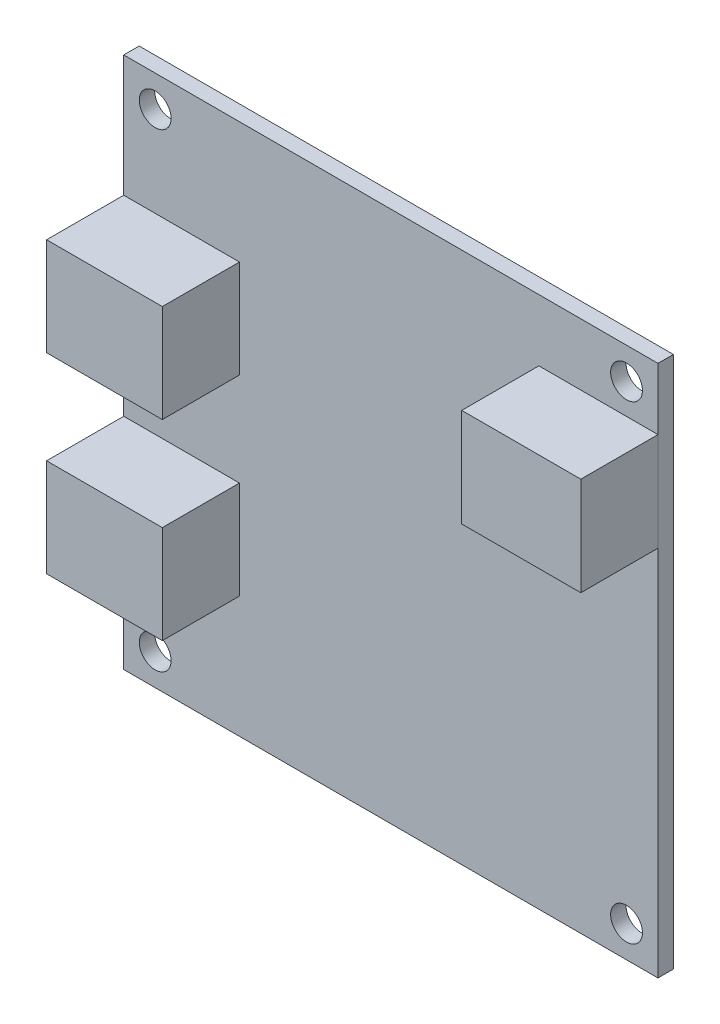
from build123d import *

# Parameters (mm, degrees)
SKETCH_1_W        = 55.4
SKETCH_1_H        = 55.2
SKETCH_1_R        = 1.65
EXTRUDE_1_DEPTH   = 1.6
SKETCH_1_3_W      = 12
SKETCH_1_3_H      = 10.15
EXTRUDE_2_DEPTH   = 8
EXTRUDE_2_2_DEPTH = 8
SKETCH_1_4_W      = 12.35
SKETCH_1_4_H      = 10.2
EXTRUDE_3_DEPTH   = 8


with BuildPart() as part:
    # 스케치1 → 보스-돌출1 (new body)
    with BuildSketch(Plane.XY):
        Rectangle(SKETCH_1_W, SKETCH_1_H)
        with Locations((-24.438224638, -24.35)):
            Circle(SKETCH_1_R, mode=Mode.SUBTRACT)
        with Locations((24.438224638, -24.35)):
            Circle(SKETCH_1_R, mode=Mode.SUBTRACT)
        with Locations((-24.438224638, 24.35)):
            Circle(SKETCH_1_R, mode=Mode.SUBTRACT)
        with Locations((24.438224638, 24.35)):
            Circle(SKETCH_1_R, mode=Mode.SUBTRACT)
    extrude(amount=-EXTRUDE_1_DEPTH)


with BuildPart() as body_2:
    # 스케치1<3> → 보스-돌출2 (new body)
    with BuildSketch(Plane.XY):
        with Locations((-21.7, -9.925)):
            Rectangle(SKETCH_1_3_W, SKETCH_1_3_H)
    extrude(amount=EXTRUDE_2_DEPTH)


with BuildPart() as body_3:
    # 스케치1<3> → Extrude 2 2 (new body)
    with BuildSketch(Plane.XY):
        with Locations((-21.7, 9.925)):
            Rectangle(SKETCH_1_3_W, SKETCH_1_3_H)
    extrude(amount=EXTRUDE_2_2_DEPTH)


with BuildPart() as body_4:
    # 스케치1<4> → 보스-돌출3 (new body)
    with BuildSketch(Plane.XY):
        with Locations((21.525, 16.1)):
            Rectangle(SKETCH_1_4_W, SKETCH_1_4_H)
    extrude(amount=EXTRUDE_3_DEPTH)


solid = Compound([part.part, body_2.part, body_3.part, body_4.part])
